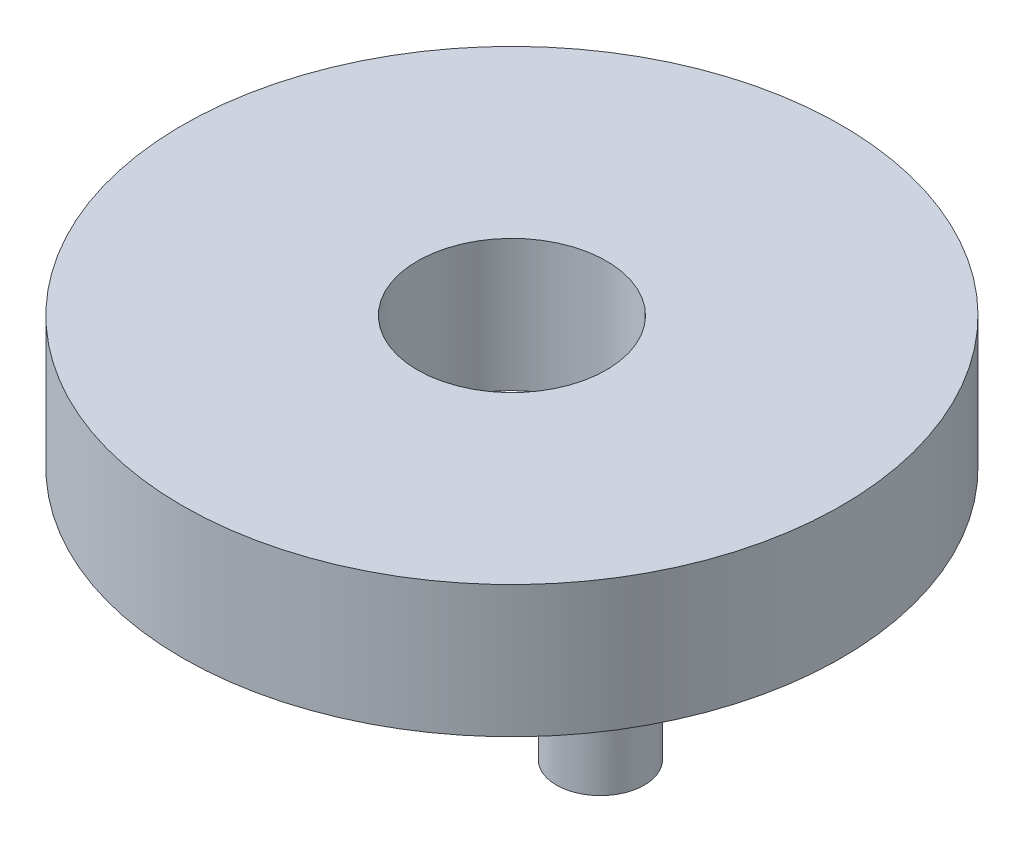
from build123d import *

# Parameters (mm, degrees)
SKETCH1_R            = 7.5
BOSS_EXTRUDE1_DEPTH  = 3
M4_CLEARANCE_HOLE1_D = 4.3
SKETCH4_R            = 1
BOSS_EXTRUDE2_DEPTH  = 2


with BuildPart() as part:
    # Sketch1 → Boss-Extrude1 (new body)
    with BuildSketch(Plane(origin=(0, 0, 0), x_dir=(1, 0, 0), z_dir=(0, 1, 0))):
        with Locations(Location((0, 0, 0), (0, 0, 270))):
            Circle(SKETCH1_R)
    extrude(amount=BOSS_EXTRUDE1_DEPTH)

    # M4 Clearance Hole1 (through all)
    with Locations(Plane(origin=(0, 3, 0), x_dir=(1, 0, 0), z_dir=(0, 1, 0))):
        with Locations((0, 0)):
            Hole(M4_CLEARANCE_HOLE1_D / 2)

    # Sketch4 → Boss-Extrude2 (add)
    with BuildSketch(Plane.XZ):
        with Locations(Location((0, -5.5, 0), (0, 0, 90))):
            Circle(SKETCH4_R)
        with Locations(Location((4.763139721, 2.75, 0), (0, 0, 90))):
            Circle(SKETCH4_R)
        with Locations(Location((-4.763139721, 2.75, 0), (0, 0, 90))):
            Circle(SKETCH4_R)
    extrude(amount=BOSS_EXTRUDE2_DEPTH)


solid = part.part
